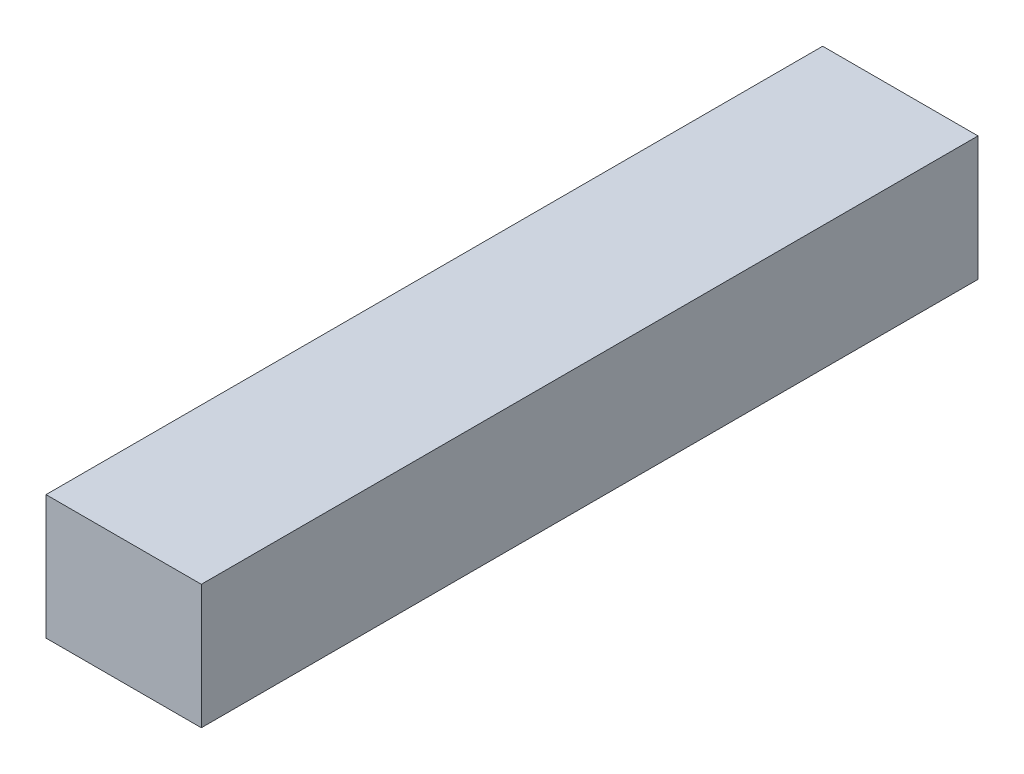
from build123d import *

# Parameters (mm, degrees)
SKETCH1_W           = 6
SKETCH1_H           = 4.8
BOSS_EXTRUDE1_DEPTH = 30


with BuildPart() as part:
    # Sketch1 → Boss-Extrude1 (new body)
    with BuildSketch(Plane.XY):
        Rectangle(SKETCH1_W, SKETCH1_H)
    extrude(amount=-BOSS_EXTRUDE1_DEPTH)


solid = part.part
